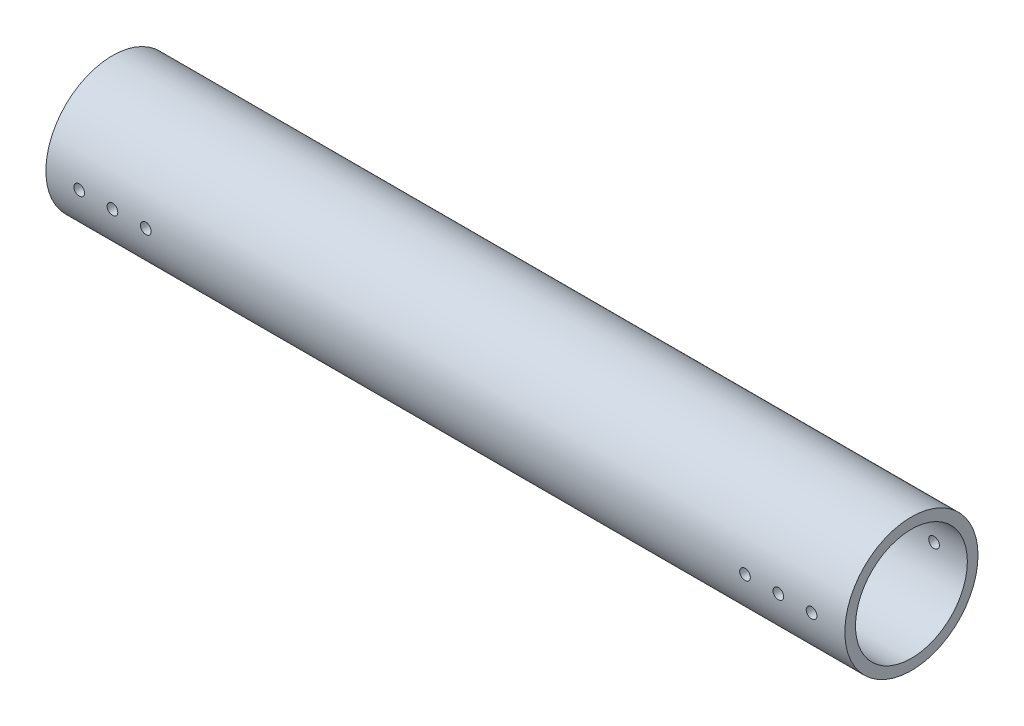
from build123d import *

# Parameters (mm, degrees)
SKETCH_2_R               = 25
SKETCH_2_R_2             = 21
EXTRUDE_2_DEPTH          = 300
CUT_EXTRUDE_2_DEPTH      = 10
CUT_EXTRUDE_2_DEPTH_BACK = 306.163890393
SKETCH_4_R               = 2


with BuildPart() as part:
    # Эскиз2 → Бобышка-Вытянуть2 (new body)
    with BuildSketch(Plane(origin=(0, 0, 0), x_dir=(0, 0, -1), z_dir=(1, 0, 0))):
        Circle(SKETCH_2_R)
        Circle(SKETCH_2_R_2, mode=Mode.SUBTRACT)
    extrude(amount=EXTRUDE_2_DEPTH)

    # Эскиз4 → Вырез-Вытянуть2 (cut, two sides: drawn at the far end of the back side and taken through both)
    with BuildSketch(Plane.XY.offset(25).offset(-CUT_EXTRUDE_2_DEPTH_BACK)):
        with Locations((12.5, 0)):
            Circle(SKETCH_4_R)
        with Locations((287.5, 0)):
            Circle(SKETCH_4_R)
        with Locations((25, 0)):
            Circle(SKETCH_4_R)
        with Locations((37.5, 0)):
            Circle(SKETCH_4_R)
        with Locations((275, 0)):
            Circle(SKETCH_4_R)
        with Locations((262.5, 0)):
            Circle(SKETCH_4_R)
    extrude(amount=CUT_EXTRUDE_2_DEPTH + CUT_EXTRUDE_2_DEPTH_BACK, mode=Mode.SUBTRACT)


solid = part.part
